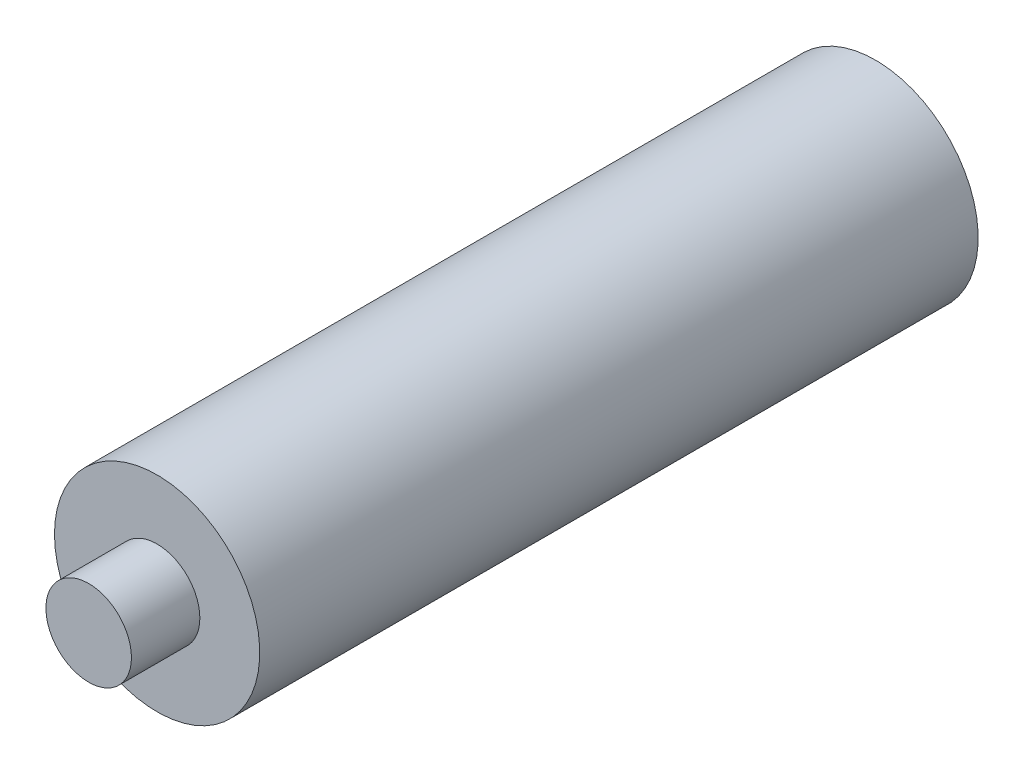
from build123d import *

# Parameters (mm, degrees)
SKETCH1_R           = 3
BOSS_EXTRUDE1_DEPTH = 21
SKETCH2_R           = 1.25
BOSS_EXTRUDE2_DEPTH = 2


with BuildPart() as part:
    # Sketch1 → Boss-Extrude1 (new body)
    with BuildSketch(Plane.XY):
        with Locations(Location((0, 0, 0), (0, 0, 180))):
            Circle(SKETCH1_R)
    extrude(amount=BOSS_EXTRUDE1_DEPTH)

    # Sketch2 → Boss-Extrude2 (add)
    with BuildSketch(Plane.XY.offset(21)):
        Circle(SKETCH2_R)
    extrude(amount=BOSS_EXTRUDE2_DEPTH)


solid = part.part
